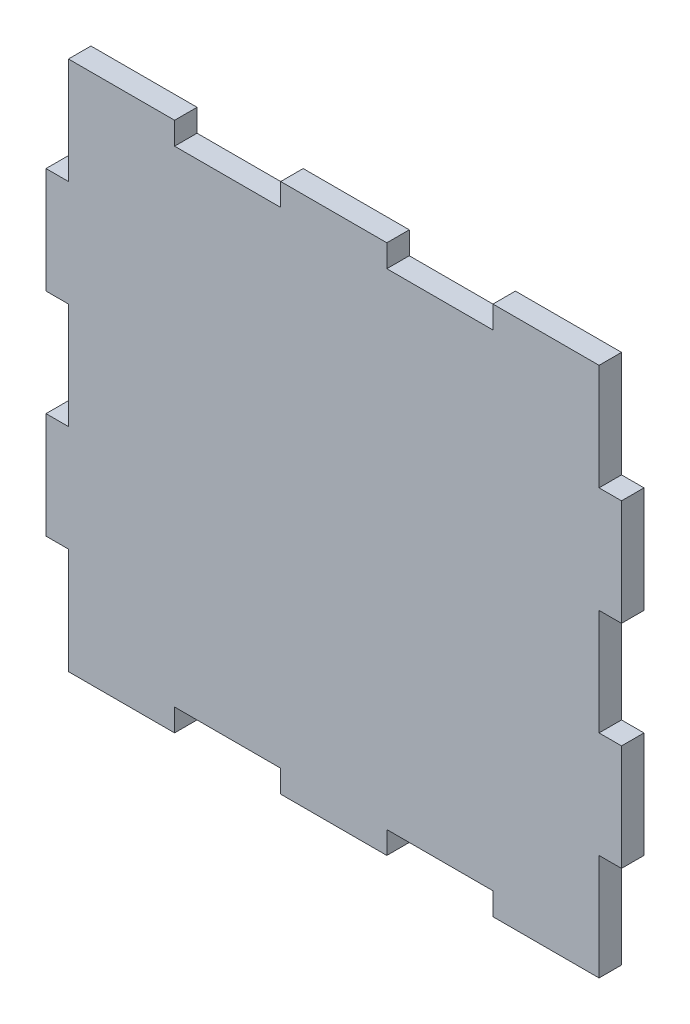
from build123d import *

# Parameters (mm, degrees)
BOSS_EXTRUDE1_DEPTH = 6.35


with BuildPart() as part:
    # Sketch1 → Boss-Extrude1 (new body)
    with BuildSketch(Plane.XY):
        Polygon((-197.413641274, 80.573248408), (-197.413641274, 50.573248408), (-203.763641274, 50.573248408), (-203.763641274, 20.573248408), (-197.413641274, 20.573248408), (-197.413641274, -9.426751592), (-203.763641274, -9.426751592), (-203.763641274, -39.426751592), (-197.413641274, -39.426751592), (-197.413641274, -69.426751592), (-167.413641274, -69.426751592), (-167.413641274, -63.076751592), (-137.413641274, -63.076751592), (-137.413641274, -69.426751592), (-107.413641274, -69.426751592), (-107.413641274, -63.076751592), (-77.413641274, -63.076751592), (-77.413641274, -69.426751592), (-47.413641274, -69.426751592), (-47.413641274, -39.426751592), (-41.063641274, -39.426751592), (-41.063641274, -9.426751592), (-47.413641274, -9.426751592), (-47.413641274, 20.573248408), (-41.063641274, 20.573248408), (-41.063641274, 50.573248408), (-47.413641274, 50.573248408), (-47.413641274, 80.573248408), (-77.413641274, 80.573248408), (-77.413641274, 74.223248408), (-107.413641274, 74.223248408), (-107.413641274, 80.573248408), (-137.413641274, 80.573248408), (-137.413641274, 74.223248408), (-167.413641274, 74.223248408), (-167.413641274, 80.573248408), align=None)
    extrude(amount=BOSS_EXTRUDE1_DEPTH)


solid = part.part
